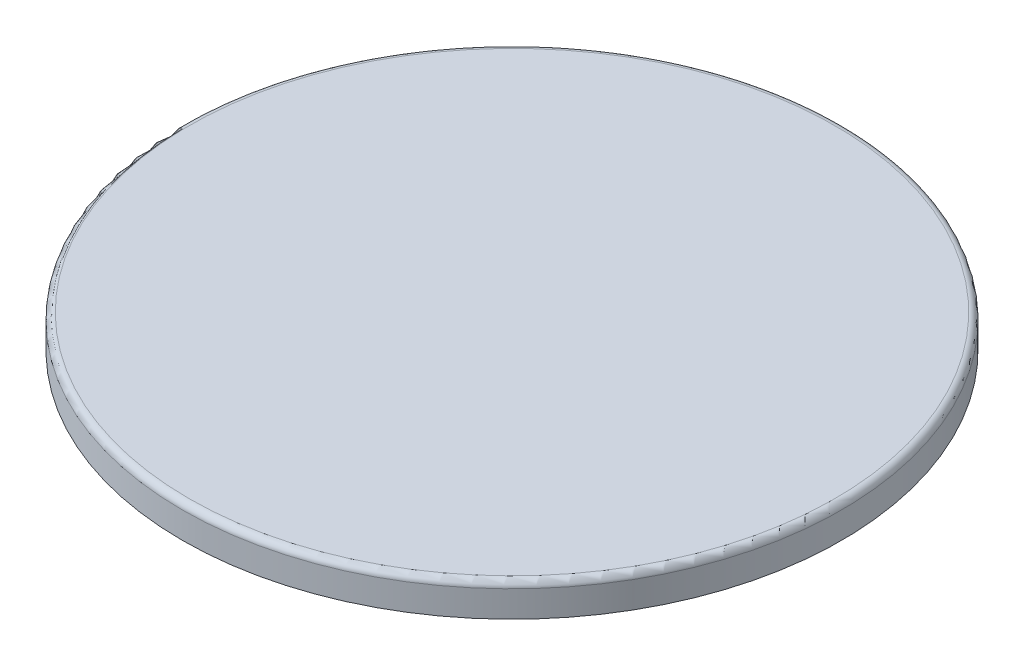
from build123d import *

# Parameters (mm, degrees)
SKETCH_1_R      = 5
EXTRUDE_1_DEPTH = 0.5
FILLET_3_R      = 0.1


with BuildPart() as part:
    # 草图1 → 凸台-拉伸1 (new body)
    with BuildSketch(Plane(origin=(0, 0, 0), x_dir=(1, 0, 0), z_dir=(0, 1, 0))):
        with Locations(Location((0, 0, 0), (0, 0, 270))):
            Circle(SKETCH_1_R)
    extrude(amount=EXTRUDE_1_DEPTH)

    # 圆角3
    fillet_3_edges = [part.edges().sort_by_distance(p)[0] for p in [
        (0, 0.5, -5),
    ]]
    fillet(fillet_3_edges, radius=FILLET_3_R)


solid = part.part
